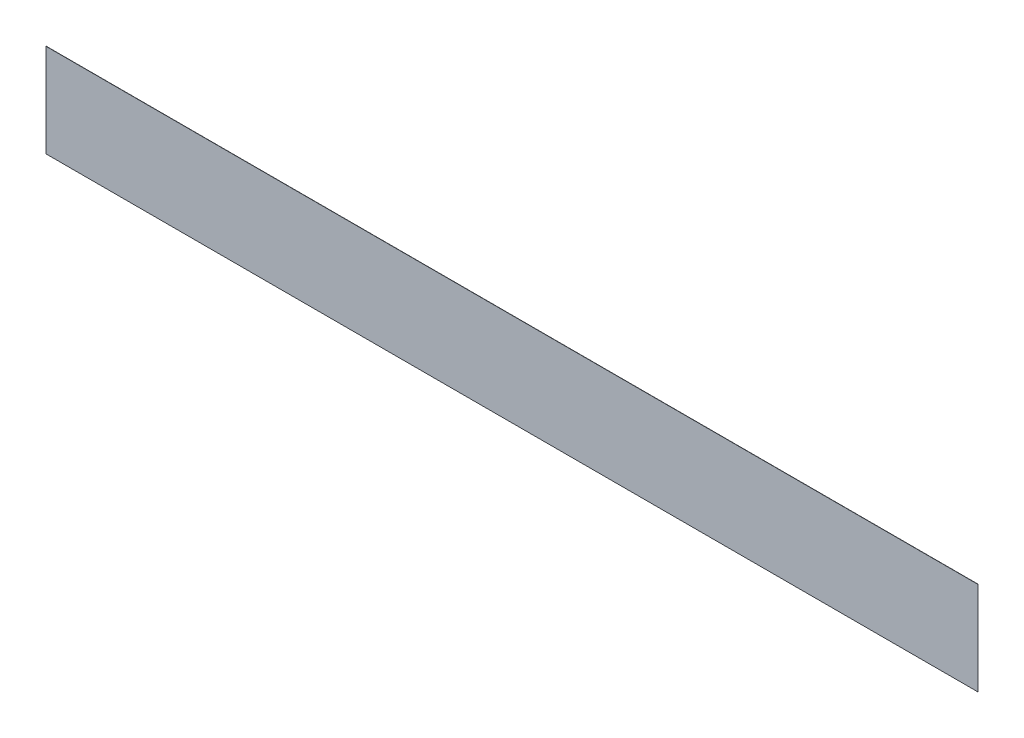
from build123d import *

# Parameters (mm, degrees)
SKETCH1_W           = 20000
SKETCH1_H           = 2000
BOSS_EXTRUDE1_DEPTH = 5


with BuildPart() as part:
    # Sketch1 → Boss-Extrude1 (new body)
    with BuildSketch(Plane.XY):
        with Locations((9950, 0)):
            Rectangle(SKETCH1_W, SKETCH1_H)
    extrude(amount=BOSS_EXTRUDE1_DEPTH)


solid = part.part
